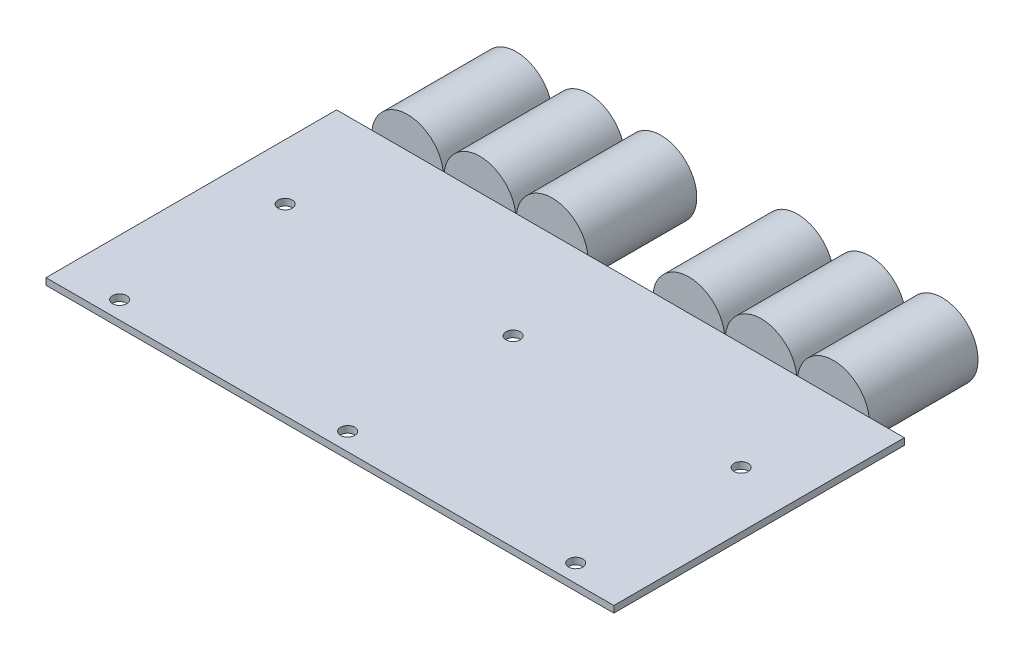
from build123d import *

# Parameters (mm, degrees)
SKETCH1_W           = 128
SKETCH1_H           = 65.5
BOSS_EXTRUDE1_DEPTH = 1.5
SKETCH2_R           = 1.6
CUT_EXTRUDE2_DEPTH  = 72.908361823
SKETCH3_W           = 105
SKETCH3_H           = 18
BOSS_EXTRUDE2_DEPTH = 1
SKETCH4_R           = 8.1
BOSS_EXTRUDE4_DEPTH = 24.5


with BuildPart() as part:
    # Sketch1 → Boss-Extrude1 (new body)
    with BuildSketch(Plane(origin=(0, 0, 0), x_dir=(1, 0, 0), z_dir=(0, 1, 0))):
        Rectangle(SKETCH1_W, SKETCH1_H)
    extrude(amount=BOSS_EXTRUDE1_DEPTH)

    # Sketch2 → Cut-Extrude2 (cut, through all)
    with BuildSketch(Plane(origin=(0, 0, 0), x_dir=(1, 0, 0), z_dir=(0, 1, 0))):
        with Locations(Location((-51.4, -28.75, 0), (0, 0, 270))):
            Circle(SKETCH2_R)
        with Locations(Location((0, -28.75, 0), (0, 0, 270))):
            Circle(SKETCH2_R)
        with Locations(Location((51.4, -28.75, 0), (0, 0, 270))):
            Circle(SKETCH2_R)
        with Locations(Location((-51.4, 8.55, 0), (0, 0, 270))):
            Circle(SKETCH2_R)
        with Locations(Location((0, 8.55, 0), (0, 0, 270))):
            Circle(SKETCH2_R)
        with Locations(Location((51.4, 8.55, 0), (0, 0, 270))):
            Circle(SKETCH2_R)
    extrude(amount=CUT_EXTRUDE2_DEPTH, mode=Mode.SUBTRACT)

    # Sketch3 → Boss-Extrude2 (add)
    with BuildSketch(Plane.XZ):
        with Locations((0, 10.75)):
            Rectangle(SKETCH3_W, SKETCH3_H)
    extrude(amount=BOSS_EXTRUDE2_DEPTH)

    # Sketch4 → Boss-Extrude4 (add)
    with BuildSketch(Plane(origin=(0, 0, -32.75), x_dir=(-1, 0, 0), z_dir=(0, 0, -1))):
        with Locations(Location((-48, 0.5, 0), (0, 0, 183.539026459))):
            Circle(SKETCH4_R)
        with Locations(Location((-31.7, 0.5, 0), (0, 0, 183.539026459))):
            Circle(SKETCH4_R)
        with Locations(Location((-15.4, 0.5, 0), (0, 0, 183.539026459))):
            Circle(SKETCH4_R)
        with Locations(Location((15.4, 0.5, 0), (0, 0, 183.539026459))):
            Circle(SKETCH4_R)
        with Locations(Location((31.7, 0.5, 0), (0, 0, 183.539026459))):
            Circle(SKETCH4_R)
        with Locations(Location((48, 0.5, 0), (0, 0, 183.539026459))):
            Circle(SKETCH4_R)
    extrude(amount=BOSS_EXTRUDE4_DEPTH)


solid = part.part
